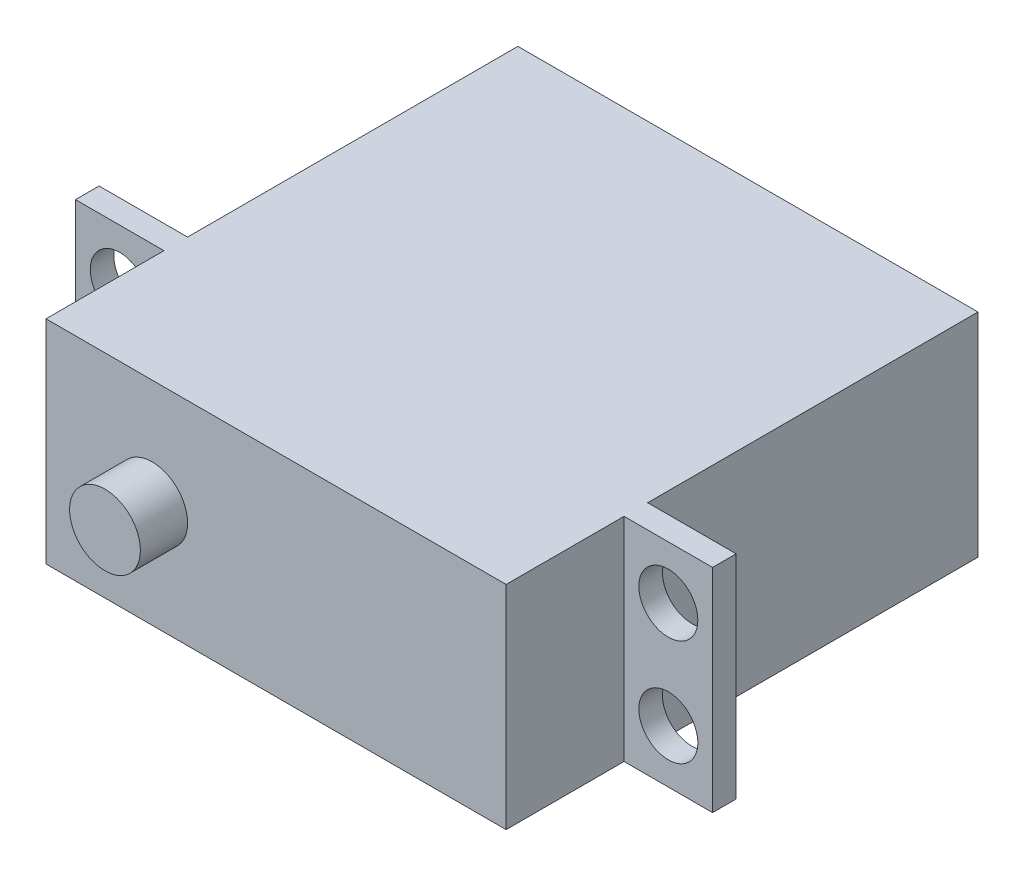
from build123d import *

# Parameters (mm, degrees)
SKETCH_1_W          = 54
SKETCH_1_H          = 18
EXTRUDE_1_DEPTH     = 2
SKETCH_2_W          = 39
SKETCH_2_H          = 18
EXTRUDE_2_DEPTH     = 10
SKETCH_3_R          = 3
EXTRUDE_3_DEPTH     = 4
SKETCH_4_W          = 39
SKETCH_4_H          = 18
EXTRUDE_4_DEPTH     = 28
SKETCH_6_R          = 2.5
CUT_EXTRUDE_1_DEPTH = 42.352146256


with BuildPart() as part:
    # 草图1 → 凸台-拉伸1 (new body)
    with BuildSketch(Plane.XY):
        Rectangle(SKETCH_1_W, SKETCH_1_H)
    extrude(amount=EXTRUDE_1_DEPTH)

    # 草图2 → 凸台-拉伸2 (add)
    with BuildSketch(Plane.XY.offset(2)):
        Rectangle(SKETCH_2_W, SKETCH_2_H)
    extrude(amount=EXTRUDE_2_DEPTH)

    # 草图3 → 凸台-拉伸3 (add)
    with BuildSketch(Plane.XY.offset(12)):
        with Locations((-10.5, 0)):
            Circle(SKETCH_3_R)
    extrude(amount=EXTRUDE_3_DEPTH)

    # 草图4 → 凸台-拉伸4 (add)
    with BuildSketch(Plane(origin=(0, 0, 0), x_dir=(-1, 0, 0), z_dir=(0, 0, -1))):
        Rectangle(SKETCH_4_W, SKETCH_4_H)
    extrude(amount=EXTRUDE_4_DEPTH)

    # 草图6 → 切除-拉伸1 (cut, through all)
    with BuildSketch(Plane.XY.offset(2)):
        with Locations((23.25, 4.5)):
            Circle(SKETCH_6_R)
        with Locations(Location((23.25, -4.5, 0), (0, 0, 180))):
            Circle(SKETCH_6_R)
        with Locations((-23.25, -4.5)):
            Circle(SKETCH_6_R)
        with Locations(Location((-23.25, 4.5, 0), (0, 0, 180))):
            Circle(SKETCH_6_R)
    extrude(amount=-CUT_EXTRUDE_1_DEPTH, mode=Mode.SUBTRACT)


solid = part.part
